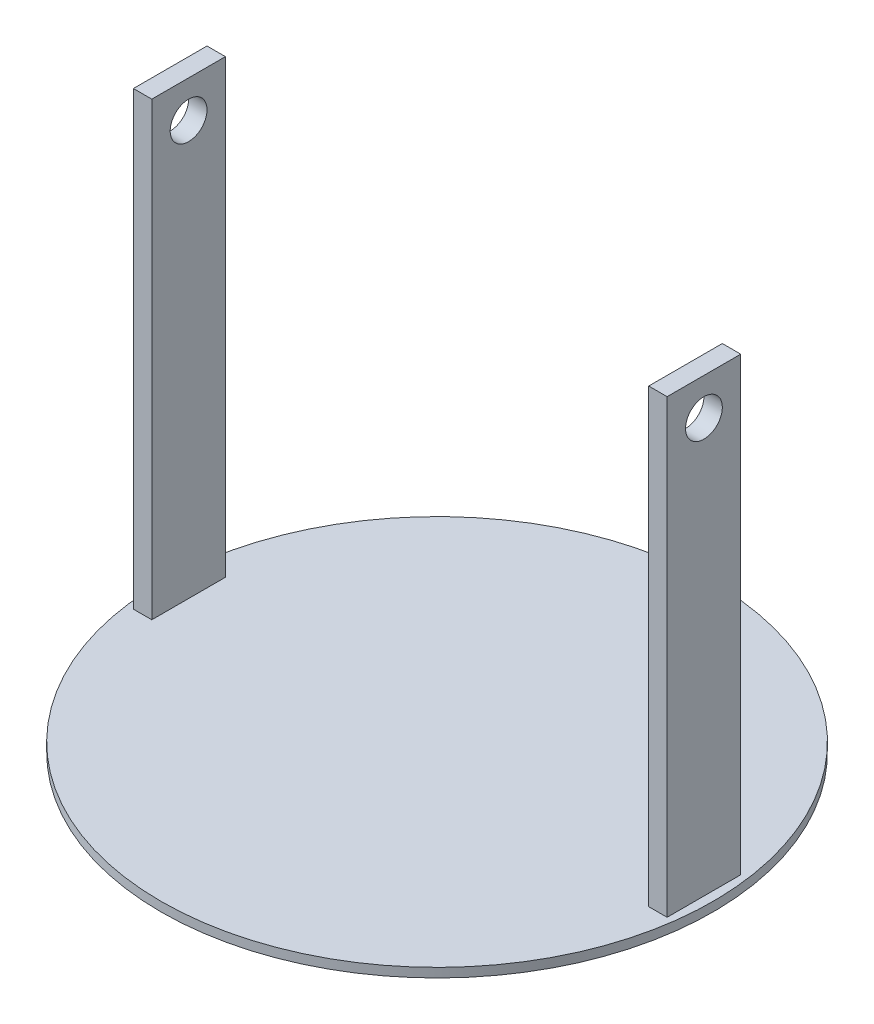
from build123d import *

# Parameters (mm, degrees)
SZKIC1_W                      = 10
SZKIC1_H                      = 40
DODANIE_WYCI_GNI_CIE1_DEPTH   = 250
DODANIE_WYCI_GNI_CIE1_2_DEPTH = 250
SZKIC1_3_R                    = 150
DODANIE_WYCI_GNI_CIE2_DEPTH   = 5
SZKIC2_R                      = 10
WYTNIJ_WYCI_GNI_CIE1_DEPTH    = 290


with BuildPart() as part:
    # Szkic1 → Dodanie-wyciągnięcie1 (new body)
    with BuildSketch(Plane(origin=(0, 0, 0), x_dir=(1, 0, 0), z_dir=(0, 1, 0))):
        with Locations((140, 0)):
            Rectangle(SZKIC1_W, SZKIC1_H)
    extrude(amount=DODANIE_WYCI_GNI_CIE1_DEPTH)



with BuildPart() as body_2:
    # Szkic1 → Dodanie-wyci_gni_cie1 2 (new body)
    with BuildSketch(Plane(origin=(0, 0, 0), x_dir=(1, 0, 0), z_dir=(0, 1, 0))):
        with Locations((-140, 0)):
            Rectangle(SZKIC1_W, SZKIC1_H)
    extrude(amount=DODANIE_WYCI_GNI_CIE1_2_DEPTH)


with BuildPart() as part_1:
    add(part.part)

    add(body_2.part)  # Dodanie-wyciągnięcie2 merges body 2
    # Szkic1<3> → Dodanie-wyciągnięcie2 (add)
    with BuildSketch(Plane(origin=(0, 0, 0), x_dir=(1, 0, 0), z_dir=(0, 1, 0))):
        Circle(SZKIC1_3_R)
        Polygon((-135, 20), (-135, 0), (-135, -20), (-140, -20), (-145, -20), (-145, 20), (-140, 20), align=None, mode=Mode.SUBTRACT)
        Polygon((135, -20), (135, 0), (135, 20), (140, 20), (145, 20), (145, -20), (140, -20), align=None, mode=Mode.SUBTRACT)
    extrude(amount=DODANIE_WYCI_GNI_CIE2_DEPTH)

    # Szkic2 → Wytnij-wyciągnięcie1 (cut)
    with BuildSketch(Plane(origin=(145, 0, 0), x_dir=(0, 0, -1), z_dir=(1, 0, 0))):
        with Locations((0, 230)):
            Circle(SZKIC2_R)
    extrude(amount=-WYTNIJ_WYCI_GNI_CIE1_DEPTH, mode=Mode.SUBTRACT)


solid = part_1.part
